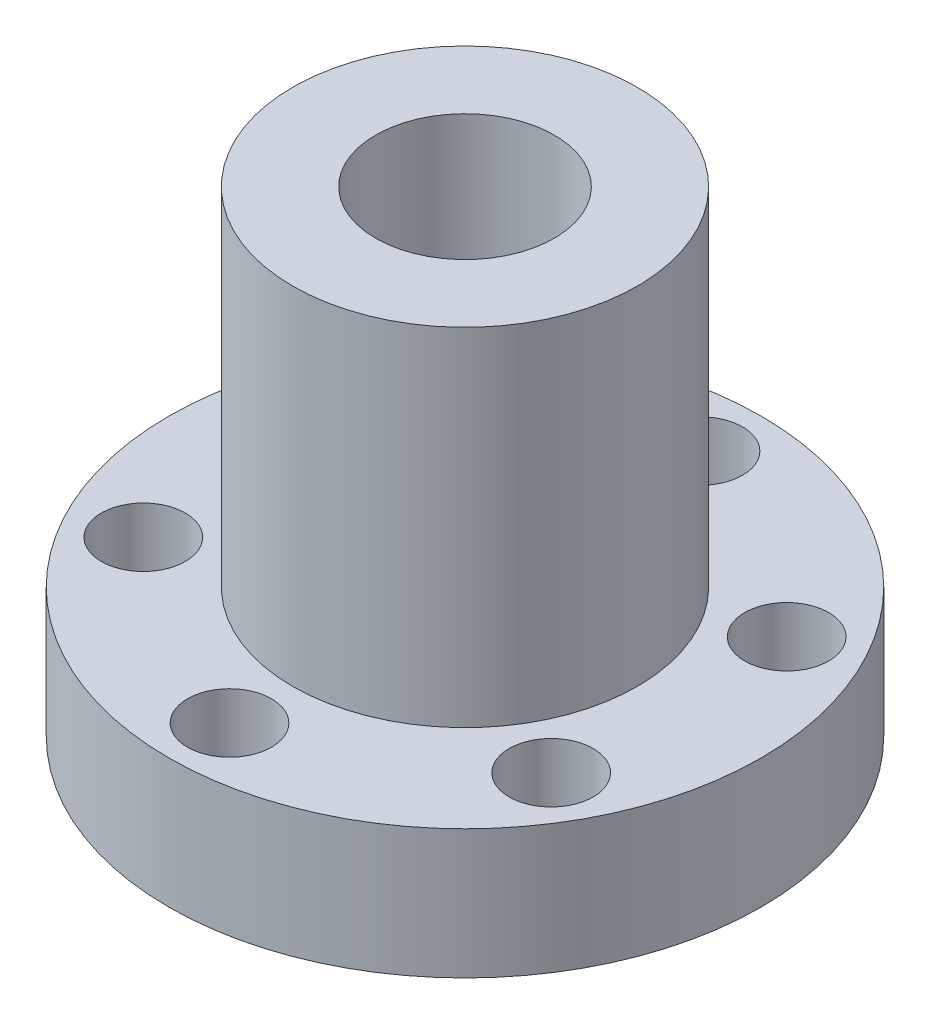
from build123d import *

# Parameters (mm, degrees)
SKETCH1_R           = 27.5
SKETCH1_R_2         = 16
BOSS_EXTRUDE1_DEPTH = 12
SKETCH1_2_R         = 16
BOSS_EXTRUDE2_DEPTH = 44.2
SKETCH3_R           = 8.3
SKETCH3_R_2         = 3.9
CUT_EXTRUDE1_DEPTH  = 59.873933111


with BuildPart() as part:
    # Sketch1 → Boss-Extrude1 (new body)
    with BuildSketch(Plane(origin=(0, 0, 0), x_dir=(1, 0, 0), z_dir=(0, 1, 0))):
        with Locations(Location((0, 0, 0), (0, 0, 270))):
            Circle(SKETCH1_R)
        with Locations(Location((0, 0, 0), (0, 0, 270))):
            Circle(SKETCH1_R_2, mode=Mode.SUBTRACT)
    extrude(amount=BOSS_EXTRUDE1_DEPTH)

    # Sketch1<2> → Boss-Extrude2 (add)
    with BuildSketch(Plane(origin=(0, 0, 0), x_dir=(1, 0, 0), z_dir=(0, 1, 0))):
        with Locations(Location((0, 0, 0), (0, 0, 270))):
            Circle(SKETCH1_2_R)
    extrude(amount=BOSS_EXTRUDE2_DEPTH)

    # Sketch3 → Cut-Extrude1 (cut, through all)
    with BuildSketch(Plane(origin=(0, 0, 0), x_dir=(1, 0, 0), z_dir=(0, 1, 0))):
        with Locations(Location((0, 0, 0), (0, 0, 270))):
            Circle(SKETCH3_R)
        with Locations(Location((0, -21.869969165, 0), (0, 0, 270))):
            Circle(SKETCH3_R_2)
        with Locations(Location((-18.939948877, -10.934984583, 0), (0, 0, 270))):
            Circle(SKETCH3_R_2)
        with Locations(Location((-18.939948877, 10.934984583, 0), (0, 0, 270))):
            Circle(SKETCH3_R_2)
        with Locations(Location((0, 21.869969165, 0), (0, 0, 270))):
            Circle(SKETCH3_R_2)
        with Locations(Location((18.939948877, 10.934984583, 0), (0, 0, 270))):
            Circle(SKETCH3_R_2)
        with Locations(Location((18.939948877, -10.934984583, 0), (0, 0, 270))):
            Circle(SKETCH3_R_2)
    extrude(amount=CUT_EXTRUDE1_DEPTH, mode=Mode.SUBTRACT)


solid = part.part
